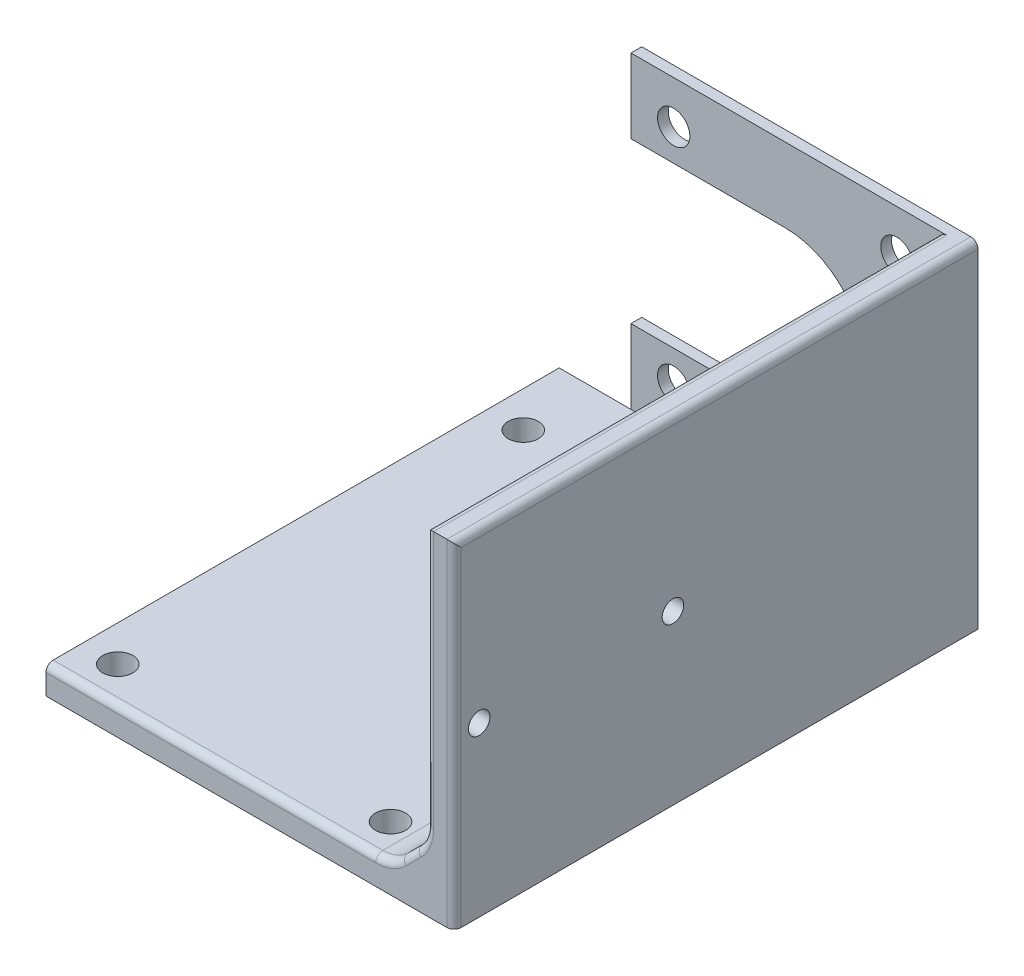
from build123d import *

# Parameters (mm, degrees)
BOSS_EXTRU_1_DEPTH      = 39
ESQUISSE2_R             = 2.25
BOSS_EXTRU_2_DEPTH      = 1.5
ESQUISSE3_W             = 34
ESQUISSE3_H             = 46.85
BOSS_EXTRU_3_DEPTH      = 3.85
ESQUISSE4_R             = 1.5
ENL_V_MAT_EXTRU_1_DEPTH = 6.5
ESQUISSE5_W             = 53
ESQUISSE5_H             = 71.5
BOSS_EXTRU_4_DEPTH      = 3.85
ESQUISSE6_R             = 2.1
ENL_V_MAT_EXTRU_2_DEPTH = 6.5
BOSS_EXTRU_5_DEPTH      = 30
CONG_1_R                = 5
CONG_2_R                = 1


with BuildPart() as part:
    # Esquisse1 → Boss.-Extru.1 (new body)
    with BuildSketch(Plane.XY):
        Polygon((0, 0), (46.85, 0), (46.85, 46.85), (43, 46.85), (43, 3.85), (0, 3.85), align=None)
    extrude(amount=BOSS_EXTRU_1_DEPTH)

    # Esquisse2 → Boss.-Extru.2 (add)
    with BuildSketch(Plane(origin=(0, 0, 0), x_dir=(-1, 0, 0), z_dir=(0, 0, -1))):
        with BuildLine():
            Line((0, 46.85), (-43, 46.85))
            Line((-43, 46.85), (-43, 3.85))
            Line((-43, 3.85), (0, 3.85))
            Line((0, 3.85), (0, 14.2))
            Line((0, 14.2), (-21.5, 14.2))
            ThreePointArc((-21.5, 14.2), (-32.65, 25.35), (-21.5, 36.5))
            Line((-21.5, 36.5), (0, 36.5))
            Line((0, 36.5), (0, 46.85))
        make_face()
        with Locations((-37.05, 9.8)):
            Circle(ESQUISSE2_R, mode=Mode.SUBTRACT)
        with Locations((-5.95, 9.8)):
            Circle(ESQUISSE2_R, mode=Mode.SUBTRACT)
        with Locations((-37.05, 40.9)):
            Circle(ESQUISSE2_R, mode=Mode.SUBTRACT)
        with Locations((-5.95, 40.9)):
            Circle(ESQUISSE2_R, mode=Mode.SUBTRACT)
    extrude(amount=-BOSS_EXTRU_2_DEPTH)

    # Esquisse3 → Boss.-Extru.3 (add)
    with BuildSketch(Plane(origin=(46.85, 0, 0), x_dir=(0, 0, -1), z_dir=(1, 0, 0))):
        with Locations((-56, 23.425)):
            Rectangle(ESQUISSE3_W, ESQUISSE3_H)
    extrude(amount=-BOSS_EXTRU_3_DEPTH)

    # Esquisse4 → Enlèv. mat.-Extru.1 (cut)
    with BuildSketch(Plane(origin=(46.85, 0, 0), x_dir=(0, 0, -1), z_dir=(1, 0, 0))):
        with Locations((-69.5, 23.425)):
            Circle(ESQUISSE4_R)
        with Locations((-42.5, 23.425)):
            Circle(ESQUISSE4_R)
    extrude(amount=-ENL_V_MAT_EXTRU_1_DEPTH, mode=Mode.SUBTRACT)

    # Esquisse5 → Boss.-Extru.4 (add)
    with BuildSketch(Plane(origin=(0, 3.85, 0), x_dir=(1, 0, 0), z_dir=(0, 1, 0))):
        with Locations((16.5, -37.25)):
            Rectangle(ESQUISSE5_W, ESQUISSE5_H)
    extrude(amount=-BOSS_EXTRU_4_DEPTH)

    # Esquisse6 → Enlèv. mat.-Extru.2 (cut)
    with BuildSketch(Plane(origin=(0, 3.85, 0), x_dir=(1, 0, 0), z_dir=(0, 1, 0))):
        with Locations(Location((-5, -68, 0), (0, 0, 180))):
            Circle(ESQUISSE6_R)
        with Locations(Location((33, -68, 0), (0, 0, 180))):
            Circle(ESQUISSE6_R)
        with Locations(Location((-5, -11.5, 0), (0, 0, 180))):
            Circle(ESQUISSE6_R)
    extrude(amount=-ENL_V_MAT_EXTRU_2_DEPTH, mode=Mode.SUBTRACT)

    # Esquisse7 → Boss.-Extru.5 (add)
    with BuildSketch(Plane.XY.offset(73)):
        Polygon((43, 3.85), (43, 8.85), (38, 3.85), align=None)
    extrude(amount=-BOSS_EXTRU_5_DEPTH)

    # Congé1
    cong_1_edges = [part.edges().sort_by_distance(p)[0] for p in [
        (38, 3.85, 58),
        (43, 8.85, 58),
    ]]
    fillet(cong_1_edges, radius=CONG_1_R)

    # Congé2
    cong_2_edges = [part.edges().sort_by_distance(p)[0] for p in [
        (12.964466094, 3.85, 73),
        (43, 46.85, 37.25),
        (46.85, 46.85, 36.5),
        (40.5, 6.35, 73),
        (43, 28.885533906, 73),
        (37.84234935, 4.230602337, 73),
        (42.619397663, 9.00765065, 73),
        (46.85, 23.425, 73),
    ]]
    fillet(cong_2_edges, radius=CONG_2_R)


solid = part.part
